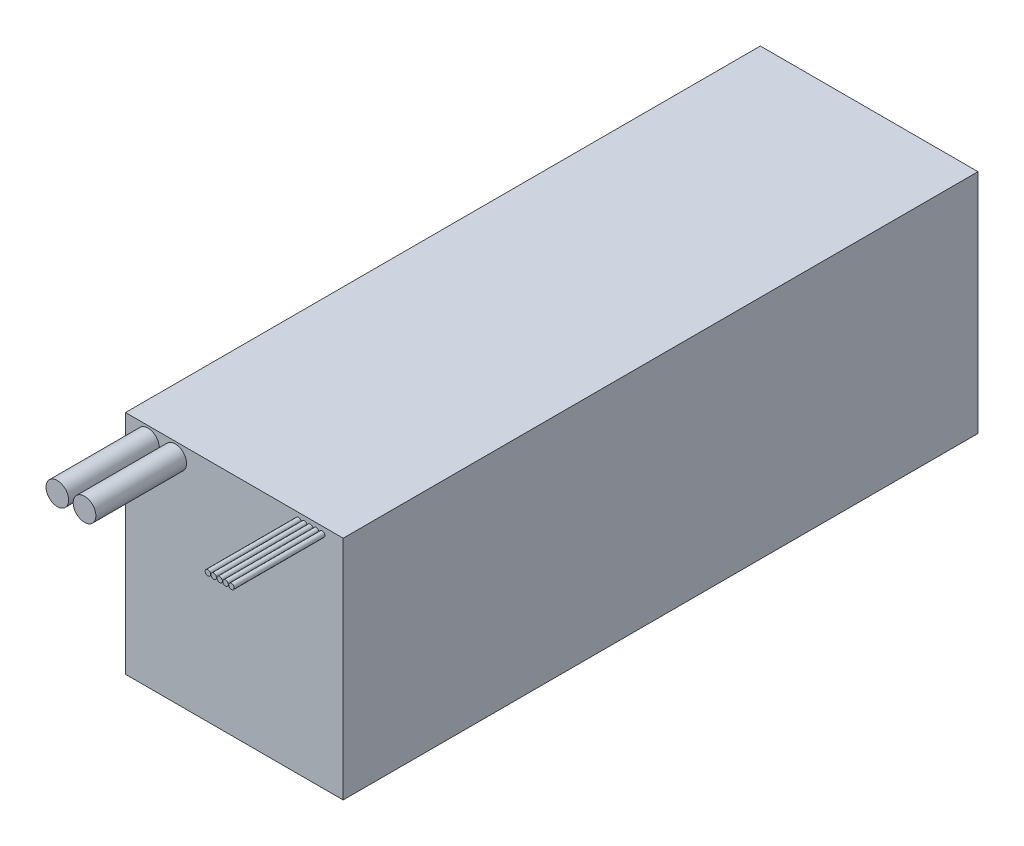
from build123d import *

# Parameters (mm, degrees)
ESQUISSE1_W        = 48
ESQUISSE1_H        = 50
BOSS_EXTRU_1_DEPTH = 70
ESQUISSE2_R        = 2.5
ESQUISSE2_R_2      = 0.6
BOSS_EXTRU_2_DEPTH = 20


with BuildPart() as part:
    # Esquisse1 → Boss.-Extru.1 (new, symmetric)
    with BuildSketch(Plane.XY):
        Rectangle(ESQUISSE1_W, ESQUISSE1_H)
    extrude(amount=BOSS_EXTRU_1_DEPTH, both=True)

    # Esquisse2 → Boss.-Extru.2 (add)
    with BuildSketch(Plane.XY.offset(70)):
        with Locations((-19.03905832, 22)):
            Circle(ESQUISSE2_R)
        with Locations((-13.03905832, 22)):
            Circle(ESQUISSE2_R)
        with Locations((15.464385939, 23.480295556)):
            Circle(ESQUISSE2_R_2)
        with Locations((16.764385939, 23.480295556)):
            Circle(ESQUISSE2_R_2)
        with Locations((18.064385939, 23.480295556)):
            Circle(ESQUISSE2_R_2)
        with Locations((19.364385939, 23.480295556)):
            Circle(ESQUISSE2_R_2)
        with Locations((14.164385939, 23.480295556)):
            Circle(ESQUISSE2_R_2)
    extrude(amount=BOSS_EXTRU_2_DEPTH)


solid = part.part
